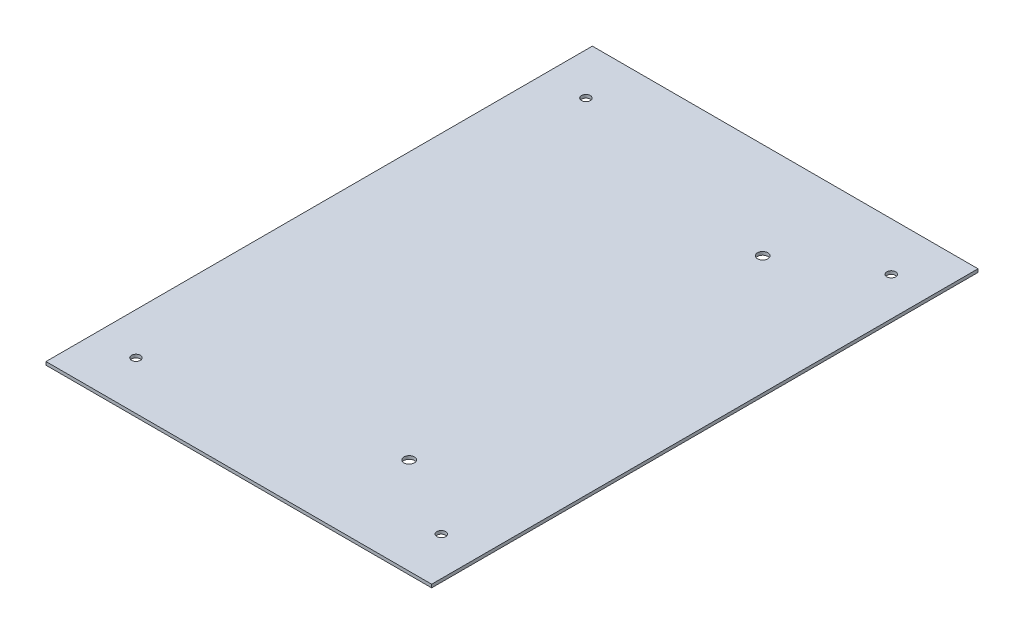
from build123d import *

# Parameters (mm, degrees)
ESQUISSE1_W                     = 240
ESQUISSE1_H                     = 2
BASE_EXTRUSION_DEPTH            = 340
ESQUISSE2_R                     = 2.75
ENL_V_MAT_EXTRU_1_DEPTH         = 417.177846599
R_P_TITION_LIN_AIRE1_COUNT      = 2
R_P_TITION_LIN_AIRE1_PITCH      = 190
R_P_TITION_LIN_AIRE1_COUNT_DIR2 = 2
R_P_TITION_LIN_AIRE1_PITCH_DIR2 = 280
ESQUISSE3_R                     = 3.25
ENL_V_MAT_EXTRU_2_DEPTH         = 417.177846599


with BuildPart() as part:
    # Esquisse1 → Base-Extrusion (new body)
    with BuildSketch(Plane.XY):
        with Locations((120, 1)):
            Rectangle(ESQUISSE1_W, ESQUISSE1_H)
    extrude(amount=BASE_EXTRUSION_DEPTH)

    # Esquisse2 → Enlèv. mat.-Extru.1 (cut, through all)
    with BuildSketch(Plane(origin=(0, 2, 0), x_dir=(-1, 0, 0), z_dir=(0, 1, 0))):
        with Locations((-216, 30)):
            Circle(ESQUISSE2_R)
    enl_v_mat_extru_1 = extrude(amount=-ENL_V_MAT_EXTRU_1_DEPTH, mode=Mode.SUBTRACT)

    # Répétition linéaire1: Enl_v. mat.-Extru.1 2 × 2
    with Locations(*[(-i * R_P_TITION_LIN_AIRE1_PITCH, 0, j * R_P_TITION_LIN_AIRE1_PITCH_DIR2) for i in range(R_P_TITION_LIN_AIRE1_COUNT) for j in range(R_P_TITION_LIN_AIRE1_COUNT_DIR2) if (i, j) != (0, 0)]):
        add(enl_v_mat_extru_1, mode=Mode.SUBTRACT)

    # Esquisse3 → Enlèv. mat.-Extru.2 (cut, through all)
    with BuildSketch(Plane(origin=(0, 2, 0), x_dir=(-1, 0, 0), z_dir=(0, 1, 0))):
        with Locations((-166, 280)):
            Circle(ESQUISSE3_R)
        with Locations((-166, 60)):
            Circle(ESQUISSE3_R)
    extrude(amount=-ENL_V_MAT_EXTRU_2_DEPTH, mode=Mode.SUBTRACT)


solid = part.part
